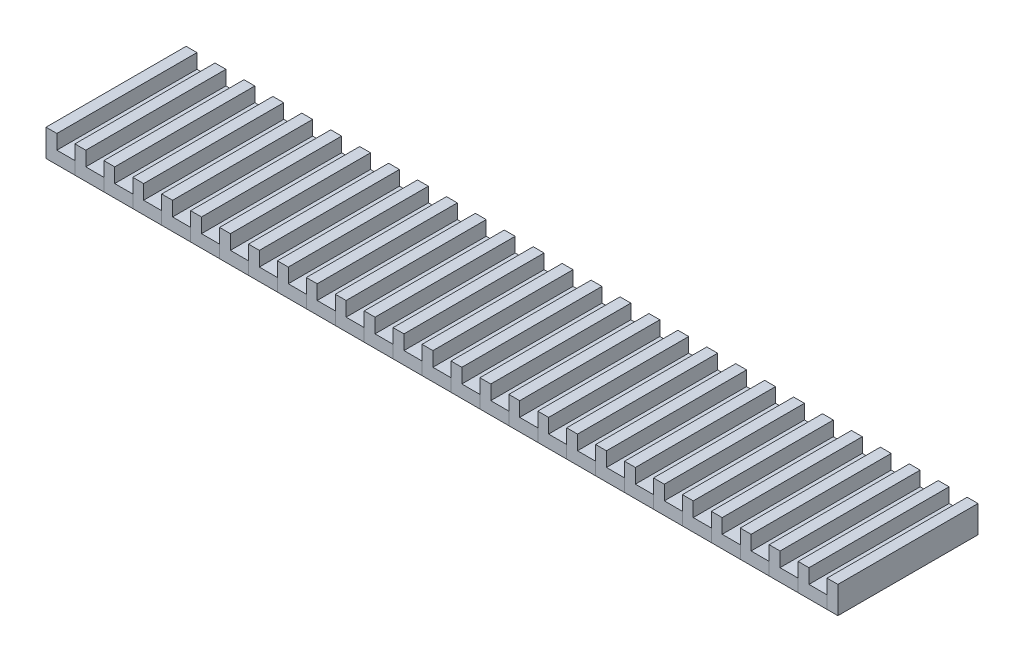
from build123d import *

# Parameters (mm, degrees)
SKETCH1_W           = 6.4
SKETCH1_H           = 31
BOSS_EXTRUDE1_DEPTH = 6
CUT_EXTRUDE1_START  = 2.8
SKETCH2_W           = 4
SKETCH2_H           = 31
CUT_EXTRUDE1_DEPTH  = 10
LPATTERN1_COUNT     = 28
LPATTERN1_PITCH     = 6.4
SKETCH3_W           = 4
SKETCH3_H           = 31
CUT_EXTRUDE2_DEPTH  = 10


with BuildPart() as part:
    # Sketch1 → Boss-Extrude1 (new body)
    with BuildSketch(Plane(origin=(0, 0, 0), x_dir=(1, 0, 0), z_dir=(0, 1, 0))):
        with Locations((3.2, 15.5)):
            Rectangle(SKETCH1_W, SKETCH1_H)
    extrude(amount=BOSS_EXTRUDE1_DEPTH)

    # Sketch2 → Cut-Extrude1 (cut)
    with BuildSketch(Plane(origin=(0, 0, 0), x_dir=(1, 0, 0), z_dir=(0, 1, 0)).offset(CUT_EXTRUDE1_START)):
        with Locations((4.4, 15.5)):
            Rectangle(SKETCH2_W, SKETCH2_H)
    extrude(amount=CUT_EXTRUDE1_DEPTH, mode=Mode.SUBTRACT)


with BuildPart() as lpattern1_1:
    # LPattern1: pattern copy
    add(part.part.moved(Location(Vector(1, 0, 0) * (1 * LPATTERN1_PITCH))))


with BuildPart() as lpattern1_2:
    # LPattern1: pattern copy
    add(part.part.moved(Location(Vector(1, 0, 0) * (2 * LPATTERN1_PITCH))))


with BuildPart() as lpattern1_3:
    # LPattern1: pattern copy
    add(part.part.moved(Location(Vector(1, 0, 0) * (3 * LPATTERN1_PITCH))))


with BuildPart() as lpattern1_4:
    # LPattern1: pattern copy
    add(part.part.moved(Location(Vector(1, 0, 0) * (4 * LPATTERN1_PITCH))))


with BuildPart() as lpattern1_5:
    # LPattern1: pattern copy
    add(part.part.moved(Location(Vector(1, 0, 0) * (5 * LPATTERN1_PITCH))))


with BuildPart() as lpattern1_6:
    # LPattern1: pattern copy
    add(part.part.moved(Location(Vector(1, 0, 0) * (6 * LPATTERN1_PITCH))))


with BuildPart() as lpattern1_7:
    # LPattern1: pattern copy
    add(part.part.moved(Location(Vector(1, 0, 0) * (7 * LPATTERN1_PITCH))))


with BuildPart() as lpattern1_8:
    # LPattern1: pattern copy
    add(part.part.moved(Location(Vector(1, 0, 0) * (8 * LPATTERN1_PITCH))))


with BuildPart() as lpattern1_9:
    # LPattern1: pattern copy
    add(part.part.moved(Location(Vector(1, 0, 0) * (9 * LPATTERN1_PITCH))))


with BuildPart() as lpattern1_10:
    # LPattern1: pattern copy
    add(part.part.moved(Location(Vector(1, 0, 0) * (10 * LPATTERN1_PITCH))))


with BuildPart() as lpattern1_11:
    # LPattern1: pattern copy
    add(part.part.moved(Location(Vector(1, 0, 0) * (11 * LPATTERN1_PITCH))))


with BuildPart() as lpattern1_12:
    # LPattern1: pattern copy
    add(part.part.moved(Location(Vector(1, 0, 0) * (12 * LPATTERN1_PITCH))))


with BuildPart() as lpattern1_13:
    # LPattern1: pattern copy
    add(part.part.moved(Location(Vector(1, 0, 0) * (13 * LPATTERN1_PITCH))))


with BuildPart() as lpattern1_14:
    # LPattern1: pattern copy
    add(part.part.moved(Location(Vector(1, 0, 0) * (14 * LPATTERN1_PITCH))))


with BuildPart() as lpattern1_15:
    # LPattern1: pattern copy
    add(part.part.moved(Location(Vector(1, 0, 0) * (15 * LPATTERN1_PITCH))))


with BuildPart() as lpattern1_16:
    # LPattern1: pattern copy
    add(part.part.moved(Location(Vector(1, 0, 0) * (16 * LPATTERN1_PITCH))))


with BuildPart() as lpattern1_17:
    # LPattern1: pattern copy
    add(part.part.moved(Location(Vector(1, 0, 0) * (17 * LPATTERN1_PITCH))))


with BuildPart() as lpattern1_18:
    # LPattern1: pattern copy
    add(part.part.moved(Location(Vector(1, 0, 0) * (18 * LPATTERN1_PITCH))))


with BuildPart() as lpattern1_19:
    # LPattern1: pattern copy
    add(part.part.moved(Location(Vector(1, 0, 0) * (19 * LPATTERN1_PITCH))))


with BuildPart() as lpattern1_20:
    # LPattern1: pattern copy
    add(part.part.moved(Location(Vector(1, 0, 0) * (20 * LPATTERN1_PITCH))))


with BuildPart() as lpattern1_21:
    # LPattern1: pattern copy
    add(part.part.moved(Location(Vector(1, 0, 0) * (21 * LPATTERN1_PITCH))))


with BuildPart() as lpattern1_22:
    # LPattern1: pattern copy
    add(part.part.moved(Location(Vector(1, 0, 0) * (22 * LPATTERN1_PITCH))))


with BuildPart() as lpattern1_23:
    # LPattern1: pattern copy
    add(part.part.moved(Location(Vector(1, 0, 0) * (23 * LPATTERN1_PITCH))))


with BuildPart() as lpattern1_24:
    # LPattern1: pattern copy
    add(part.part.moved(Location(Vector(1, 0, 0) * (24 * LPATTERN1_PITCH))))


with BuildPart() as lpattern1_25:
    # LPattern1: pattern copy
    add(part.part.moved(Location(Vector(1, 0, 0) * (25 * LPATTERN1_PITCH))))


with BuildPart() as lpattern1_26:
    # LPattern1: pattern copy
    add(part.part.moved(Location(Vector(1, 0, 0) * (26 * LPATTERN1_PITCH))))


with BuildPart() as lpattern1_27:
    # LPattern1: pattern copy
    add(part.part.moved(Location(Vector(1, 0, 0) * (27 * LPATTERN1_PITCH))))

    # Sketch3 → Cut-Extrude2 (cut)
    with BuildSketch(Plane(origin=(0, 2.8, 0), x_dir=(1, 0, 0), z_dir=(0, 1, 0))):
        with Locations((177.2, 15.5)):
            Rectangle(SKETCH3_W, SKETCH3_H)
    extrude(amount=-CUT_EXTRUDE2_DEPTH, mode=Mode.SUBTRACT)


solid = Compound([part.part, lpattern1_1.part, lpattern1_2.part, lpattern1_3.part, lpattern1_4.part, lpattern1_5.part, lpattern1_6.part, lpattern1_7.part, lpattern1_8.part, lpattern1_9.part, lpattern1_10.part, lpattern1_11.part, lpattern1_12.part, lpattern1_13.part, lpattern1_14.part, lpattern1_15.part, lpattern1_16.part, lpattern1_17.part, lpattern1_18.part, lpattern1_19.part, lpattern1_20.part, lpattern1_21.part, lpattern1_22.part, lpattern1_23.part, lpattern1_24.part, lpattern1_25.part, lpattern1_26.part, lpattern1_27.part])
